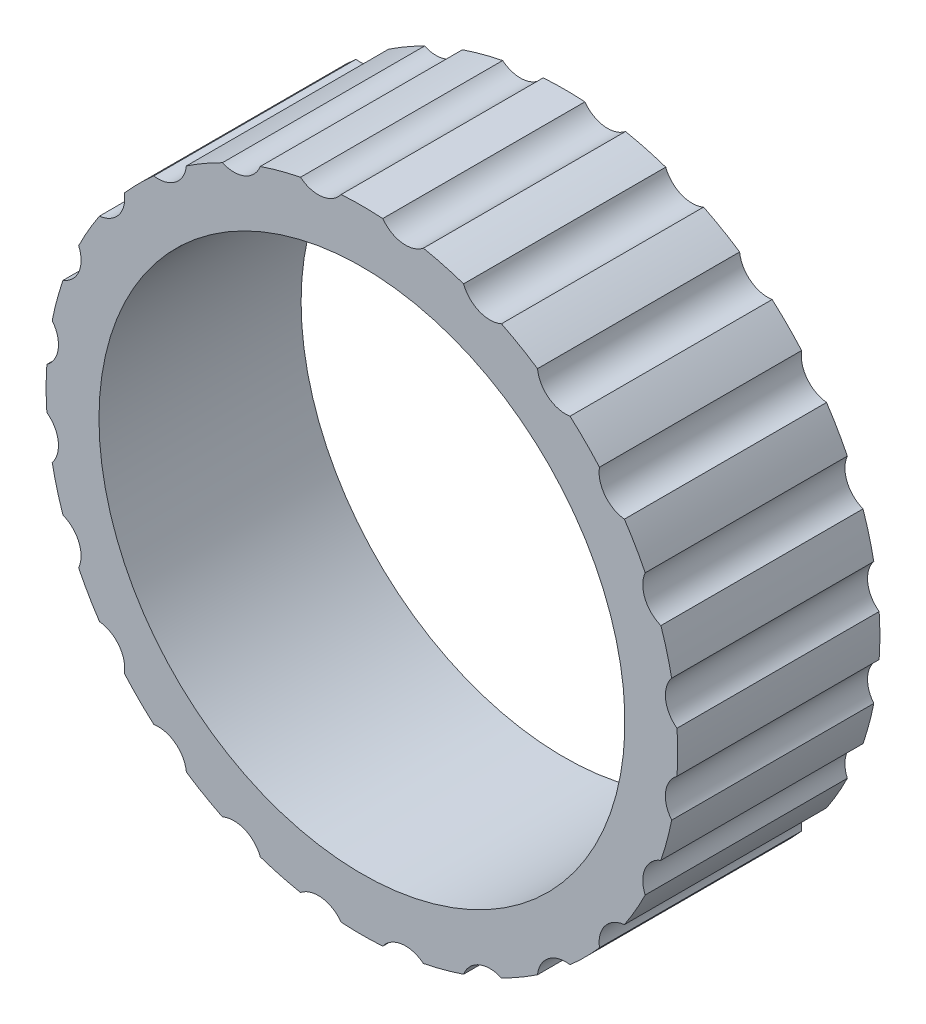
from build123d import *

# Parameters (mm, degrees)
PD_R               = 19.098593171
HALF_WIDTH_DEPTH   = 10.67
TEETH_START        = -10.67
TEETH_DEPTH        = 10.67
CIRPATTERN1_COUNT  = 24
SKETCH4_R          = 20.022921169
SKETCH4_R_2        = 16.668593171
CUT_EXTRUDE1_DEPTH = 28.900037957
SKETCH5_R          = 13.880990835
CUT_EXTRUDE2_DEPTH = 26.875333749


with BuildPart() as part:
    # PD → half width (new body)
    with BuildSketch(Plane.XY):
        Circle(PD_R)
    extrude(amount=HALF_WIDTH_DEPTH)

    # Sketch3 → Teeth (cut)
    with BuildSketch(Plane.XY.offset(10.67).offset(TEETH_START)):
        with BuildLine():
            Line((0, 18.228593171), (0.407100386, 18.228593171))
            ThreePointArc((0.407100386, 18.228593171), (0.733390757, 18.078654939), (0.832130423, 17.733405235))
            ThreePointArc((0.832130423, 17.733405235), (2.1104249, 16.030268615), (3.785966743, 17.344525307))
            ThreePointArc((3.785966743, 17.344525307), (3.970699136, 17.652455205), (4.324678302, 17.712834254))
            Line((4.324678302, 17.712834254), (4.717907078, 17.607468921))
            Line((4.717907078, 17.607468921), (4.943079647, 18.44782439))
            ThreePointArc((4.943079647, 18.44782439), (2.492866643, 18.935202059), (0, 19.098593171))
            Line((0, 19.098593171), (0, 18.228593171))
        make_face()
    teeth = extrude(amount=TEETH_DEPTH, mode=Mode.SUBTRACT)

    # CirPattern1: Teeth ×24 about axis
    cirpattern1_axis = Axis((0, 0, 0), (0, 0, 1))
    for i in range(1, CIRPATTERN1_COUNT):
        add(teeth.rotate(cirpattern1_axis, i * 360 / CIRPATTERN1_COUNT), mode=Mode.SUBTRACT)

    # Sketch4 → Cut-Extrude1 (cut, through all)
    with BuildSketch(Plane(origin=(0, 0, 0), x_dir=(-1, 0, 0), z_dir=(0, 0, -1))):
        Circle(SKETCH4_R)
        Circle(SKETCH4_R_2, mode=Mode.SUBTRACT)
    extrude(amount=-CUT_EXTRUDE1_DEPTH, mode=Mode.SUBTRACT)

    # Sketch5 → Cut-Extrude2 (cut, through all)
    with BuildSketch(Plane(origin=(0, 0, 0), x_dir=(-1, 0, 0), z_dir=(0, 0, -1))):
        Circle(SKETCH5_R)
    extrude(amount=-CUT_EXTRUDE2_DEPTH, mode=Mode.SUBTRACT)


solid = part.part
